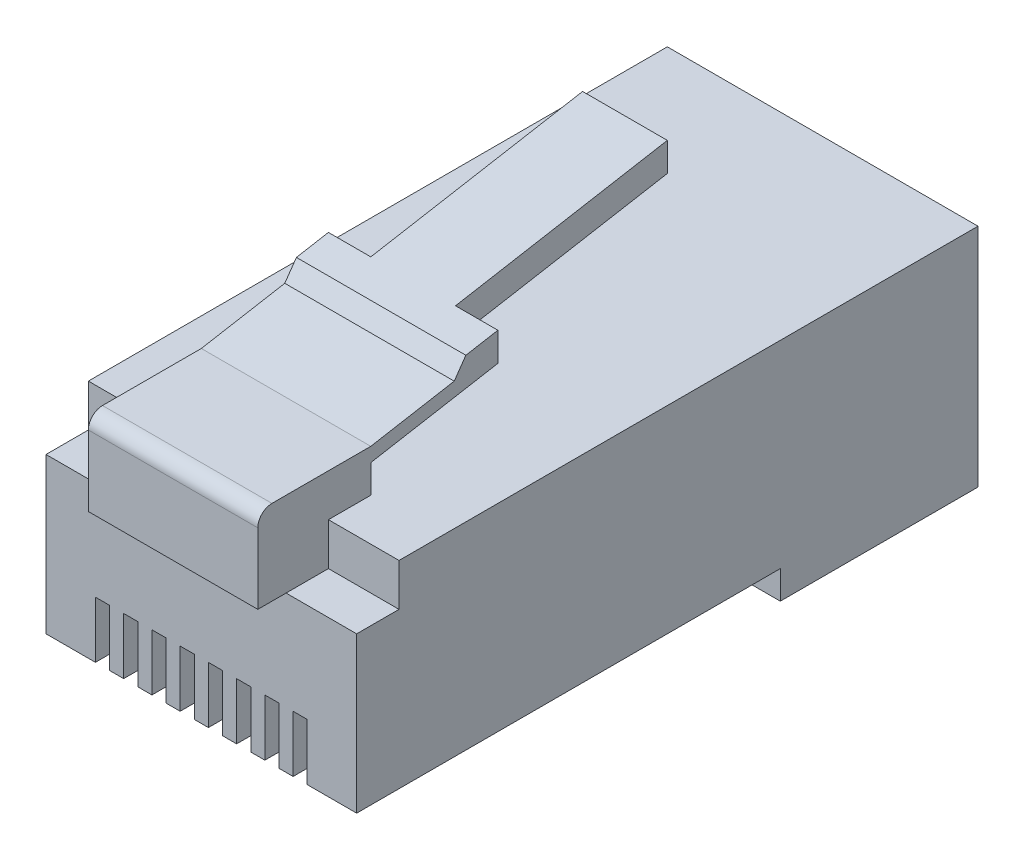
from build123d import *

# Parameters (mm, degrees)
SCHIZZO1_W                           = 11
SCHIZZO1_H                           = 8
ESTRUSIONE_ESTRUSIONE1_DEPTH         = 7
SCHIZZO2_W                           = 11
SCHIZZO2_H                           = 7
ESTRUSIONE_ESTRUSIONE2_DEPTH         = 15
TAGLIO_ESTRUSIONE1_DEPTH             = 7
SCHIZZO4_W                           = 9
SCHIZZO4_H                           = 3
TAGLIO_ESTRUSIONE2_DEPTH             = 2
TAGLIO_ESTRUSIONE3_REACH             = 25.027
SCHIZZO5_W                           = 2
SCHIZZO5_H                           = 3
TAGLIO_ESTRUSIONE3_DIRECTION_2_REACH = 25.027
SCHIZZO6_W                           = 0.5
SCHIZZO6_H                           = 3
TAGLIO_ESTRUSIONE4_DEPTH             = 4
SCHIZZO7_W                           = 0.5
SCHIZZO7_H                           = 0.5
TAGLIO_ESTRUSIONE5_DEPTH             = 2
ESTRUSIONE_ESTRUSIONE7_DEPTH         = 4
ESTRUSIONE_ESTRUSIONE7_DEPTH_BACK    = 4
SCHIZZO9_W                           = 0.5
SCHIZZO9_H                           = 7
SCHIZZO9_W_2                         = 0.75
ESTRUSIONE_ESTRUSIONE8_DEPTH         = 0.5
RACCORDO1_R                          = 0.2
SMUSSO1_SIZE                         = 0.2
SCHIZZO10_W                          = 1.5
SCHIZZO10_H                          = 1.5
TAGLIO_ESTRUSIONE6_DEPTH             = 25.919871589
ESTRUSIONE_ESTRUSIONE9_DEPTH         = 3
ESTRUSIONE_ESTRUSIONE9_DEPTH_BACK    = 3
SCHIZZO12_W                          = 1.5
SCHIZZO12_H                          = 3.13135038
TAGLIO_ESTRUSIONE7_DEPTH             = 7.5


with BuildPart() as part:
    # Schizzo1 → Estrusione-Estrusione1 (new body)
    with BuildSketch(Plane.XY):
        Rectangle(SCHIZZO1_W, SCHIZZO1_H)
    extrude(amount=ESTRUSIONE_ESTRUSIONE1_DEPTH)

    # Schizzo2 → Estrusione-Estrusione2 (add)
    with BuildSketch(Plane.XY.offset(7)):
        with Locations((0, 0.5)):
            Rectangle(SCHIZZO2_W, SCHIZZO2_H)
    extrude(amount=ESTRUSIONE_ESTRUSIONE2_DEPTH)

    # Schizzo3 → Taglio-Estrusione1 (cut)
    with BuildSketch(Plane(origin=(0, 0, 0), x_dir=(-1, 0, 0), z_dir=(0, 0, -1))):
        with BuildLine():
            Line((-4.5, 2.5), (-4.5, -2))
            Line((-4.5, -2), (4.5, -2))
            Line((4.5, -2), (4.5, 2.5))
            ThreePointArc((4.5, 2.5), (0, 3.56971445), (-4.5, 2.5))
        make_face()
    extrude(amount=-TAGLIO_ESTRUSIONE1_DEPTH, mode=Mode.SUBTRACT)

    # Schizzo4 → Taglio-Estrusione2 (cut)
    with BuildSketch(Plane.XZ.offset(4)):
        with Locations((0, 4.5)):
            Rectangle(SCHIZZO4_W, SCHIZZO4_H)
    extrude(amount=-TAGLIO_ESTRUSIONE2_DEPTH, mode=Mode.SUBTRACT)

    # Taglio-Estrusione3: up to this face of the body (flat: up to its plane)
    taglio_estrusione3_end = Plane(part.part.faces().sort_by_distance((-4.5, -0.27, 3.66))[0])
    # Schizzo5 → Taglio-Estrusione3 (cut, up to the picked face)
    with BuildSketch(Plane(origin=(0, 0, 0), x_dir=(0, 0, -1), z_dir=(1, 0, 0)), mode=Mode.PRIVATE) as taglio_estrusione3_sk1:
        with BuildLine():
            Line((-7, -2), (-7, 2.5))
            Line((-7, 2.5), (-8, 2.5))
            Line((-8, 2.5), (-8.5, 2))
            Line((-8.5, 2), (-21.5, 2))
            Line((-21.5, 2), (-21.5, 1))
            Line((-21.5, 1), (-12.196152423, 1))
            ThreePointArc((-12.196152423, 1), (-9.196152423, 0.196152423), (-7, -2))
        make_face()
    taglio_estrusione3_tool1 = split(extrude(taglio_estrusione3_sk1.sketch, amount=-TAGLIO_ESTRUSIONE3_REACH, mode=Mode.PRIVATE), bisect_by=taglio_estrusione3_end, keep=Keep.BOTH, mode=Mode.PRIVATE)
    # Schizzo5 → Taglio-Estrusione3 (cut, up to the picked face)
    with BuildSketch(Plane(origin=(0, 0, 0), x_dir=(0, 0, -1), z_dir=(1, 0, 0)), mode=Mode.PRIVATE) as taglio_estrusione3_sk2:
        Polygon((-9, -3), (-9, -1.5), (-10, -0.5), (-12.5, -0.5), (-12.5, -3), align=None)
    taglio_estrusione3_tool2 = split(extrude(taglio_estrusione3_sk2.sketch, amount=-TAGLIO_ESTRUSIONE3_REACH, mode=Mode.PRIVATE), bisect_by=taglio_estrusione3_end, keep=Keep.BOTH, mode=Mode.PRIVATE)
    # Schizzo5 → Taglio-Estrusione3 (cut, up to the picked face)
    with BuildSketch(Plane(origin=(0, 0, 0), x_dir=(0, 0, -1), z_dir=(1, 0, 0)), mode=Mode.PRIVATE) as taglio_estrusione3_sk3:
        with Locations((-15, -1.5)):
            Rectangle(SCHIZZO5_W, SCHIZZO5_H)
    taglio_estrusione3_tool3 = split(extrude(taglio_estrusione3_sk3.sketch, amount=-TAGLIO_ESTRUSIONE3_REACH, mode=Mode.PRIVATE), bisect_by=taglio_estrusione3_end, keep=Keep.BOTH, mode=Mode.PRIVATE)
    add(taglio_estrusione3_tool1.solids().sort_by(Axis((0, 1.213893, 12.650368), (-1, 0, 0)))[0], mode=Mode.SUBTRACT)
    add(taglio_estrusione3_tool2.solids().sort_by(Axis((0, -1.805556, 10.835859), (-1, 0, 0)))[0], mode=Mode.SUBTRACT)
    add(taglio_estrusione3_tool3.solids().sort_by(Axis((0, -1.5, 15), (-1, 0, 0)))[0], mode=Mode.SUBTRACT)

    # Taglio-Estrusione3 direction 2: up to this face of the body (flat: up to its plane)
    taglio_estrusione3_direction_2_end = Plane(part.part.faces().sort_by_distance((4.5, -0.27, 3.66))[0])
    # Schizzo5 → Taglio-Estrusione3 direction 2 (cut, up to the picked face)
    with BuildSketch(Plane(origin=(0, 0, 0), x_dir=(0, 0, -1), z_dir=(1, 0, 0)), mode=Mode.PRIVATE) as taglio_estrusione3_direction_2_sk1:
        with BuildLine():
            Line((-7, -2), (-7, 2.5))
            Line((-7, 2.5), (-8, 2.5))
            Line((-8, 2.5), (-8.5, 2))
            Line((-8.5, 2), (-21.5, 2))
            Line((-21.5, 2), (-21.5, 1))
            Line((-21.5, 1), (-12.196152423, 1))
            ThreePointArc((-12.196152423, 1), (-9.196152423, 0.196152423), (-7, -2))
        make_face()
    taglio_estrusione3_direction_2_tool1 = split(extrude(taglio_estrusione3_direction_2_sk1.sketch, amount=TAGLIO_ESTRUSIONE3_DIRECTION_2_REACH, mode=Mode.PRIVATE), bisect_by=taglio_estrusione3_direction_2_end, keep=Keep.BOTH, mode=Mode.PRIVATE)
    # Schizzo5 → Taglio-Estrusione3 direction 2 (cut, up to the picked face)
    with BuildSketch(Plane(origin=(0, 0, 0), x_dir=(0, 0, -1), z_dir=(1, 0, 0)), mode=Mode.PRIVATE) as taglio_estrusione3_direction_2_sk2:
        Polygon((-9, -3), (-9, -1.5), (-10, -0.5), (-12.5, -0.5), (-12.5, -3), align=None)
    taglio_estrusione3_direction_2_tool2 = split(extrude(taglio_estrusione3_direction_2_sk2.sketch, amount=TAGLIO_ESTRUSIONE3_DIRECTION_2_REACH, mode=Mode.PRIVATE), bisect_by=taglio_estrusione3_direction_2_end, keep=Keep.BOTH, mode=Mode.PRIVATE)
    # Schizzo5 → Taglio-Estrusione3 direction 2 (cut, up to the picked face)
    with BuildSketch(Plane(origin=(0, 0, 0), x_dir=(0, 0, -1), z_dir=(1, 0, 0)), mode=Mode.PRIVATE) as taglio_estrusione3_direction_2_sk3:
        with Locations((-15, -1.5)):
            Rectangle(SCHIZZO5_W, SCHIZZO5_H)
    taglio_estrusione3_direction_2_tool3 = split(extrude(taglio_estrusione3_direction_2_sk3.sketch, amount=TAGLIO_ESTRUSIONE3_DIRECTION_2_REACH, mode=Mode.PRIVATE), bisect_by=taglio_estrusione3_direction_2_end, keep=Keep.BOTH, mode=Mode.PRIVATE)
    add(taglio_estrusione3_direction_2_tool1.solids().sort_by(Axis((0, 1.213893, 12.650368), (1, 0, 0)))[0], mode=Mode.SUBTRACT)
    add(taglio_estrusione3_direction_2_tool2.solids().sort_by(Axis((0, -1.805556, 10.835859), (1, 0, 0)))[0], mode=Mode.SUBTRACT)
    add(taglio_estrusione3_direction_2_tool3.solids().sort_by(Axis((0, -1.5, 15), (1, 0, 0)))[0], mode=Mode.SUBTRACT)

    # Schizzo6 → Taglio-Estrusione4 (cut)
    with BuildSketch(Plane.XZ.offset(3)):
        with Locations((-3.5, 20)):
            Rectangle(SCHIZZO6_W, SCHIZZO6_H)
        with Locations((-2.5, 20)):
            Rectangle(SCHIZZO6_W, SCHIZZO6_H)
        with Locations((-1.5, 20)):
            Rectangle(SCHIZZO6_W, SCHIZZO6_H)
        with Locations((-0.5, 20)):
            Rectangle(SCHIZZO6_W, SCHIZZO6_H)
        with Locations((0.5, 20)):
            Rectangle(SCHIZZO6_W, SCHIZZO6_H)
        with Locations((1.5, 20)):
            Rectangle(SCHIZZO6_W, SCHIZZO6_H)
        with Locations((2.5, 20)):
            Rectangle(SCHIZZO6_W, SCHIZZO6_H)
        with Locations((3.5, 20)):
            Rectangle(SCHIZZO6_W, SCHIZZO6_H)
    extrude(amount=-TAGLIO_ESTRUSIONE4_DEPTH, mode=Mode.SUBTRACT)

    # Schizzo7 → Taglio-Estrusione5 (cut)
    with BuildSketch(Plane.XZ.offset(3)):
        with Locations((-3.5, 21.75)):
            Rectangle(SCHIZZO7_W, SCHIZZO7_H)
        with Locations((-2.5, 21.75)):
            Rectangle(SCHIZZO7_W, SCHIZZO7_H)
        with Locations((-1.5, 21.75)):
            Rectangle(SCHIZZO7_W, SCHIZZO7_H)
        with Locations((-0.5, 21.75)):
            Rectangle(SCHIZZO7_W, SCHIZZO7_H)
        with Locations((0.5, 21.75)):
            Rectangle(SCHIZZO7_W, SCHIZZO7_H)
        with Locations((1.5, 21.75)):
            Rectangle(SCHIZZO7_W, SCHIZZO7_H)
        with Locations((2.5, 21.75)):
            Rectangle(SCHIZZO7_W, SCHIZZO7_H)
        with Locations((3.5, 21.75)):
            Rectangle(SCHIZZO7_W, SCHIZZO7_H)
    extrude(amount=-TAGLIO_ESTRUSIONE5_DEPTH, mode=Mode.SUBTRACT)

    # Schizzo8 → Estrusione-Estrusione7 (add, two sides: drawn at the far end of the back side and taken through both)
    with BuildSketch(Plane(origin=(0, 0, 0), x_dir=(0, 0, -1), z_dir=(1, 0, 0)).offset(-ESTRUSIONE_ESTRUSIONE7_DEPTH_BACK)):
        with BuildLine():
            Line((-6, -2), (-6, -2.3))
            Line((-6, -2.3), (-5.022904001, -2.512798985))
            Line((-5.022904001, -2.512798985), (-3.268414576, -4))
            Line((-3.268414576, -4), (-3.031110437, -2.785373321))
            ThreePointArc((-3.031110437, -2.785373321), (-3.051323254, -2.652170285), (-3.151437659, -2.562010912))
            ThreePointArc((-3.151437659, -2.562010912), (-4.548262793, -2.141844043), (-6, -2))
        make_face()
    extrude(amount=ESTRUSIONE_ESTRUSIONE7_DEPTH + ESTRUSIONE_ESTRUSIONE7_DEPTH_BACK)

    # Schizzo9 → Estrusione-Estrusione8 (add)
    with BuildSketch(Plane(origin=(0, 1, 0), x_dir=(1, 0, 0), z_dir=(0, 1, 0))):
        with Locations((-3, -18)):
            Rectangle(SCHIZZO9_W, SCHIZZO9_H)
        with Locations((-2, -18)):
            Rectangle(SCHIZZO9_W, SCHIZZO9_H)
        with Locations((-1, -18)):
            Rectangle(SCHIZZO9_W, SCHIZZO9_H)
        with Locations((0, -18)):
            Rectangle(SCHIZZO9_W, SCHIZZO9_H)
        with Locations((1, -18)):
            Rectangle(SCHIZZO9_W, SCHIZZO9_H)
        with Locations((2, -18)):
            Rectangle(SCHIZZO9_W, SCHIZZO9_H)
        with Locations((3, -18)):
            Rectangle(SCHIZZO9_W, SCHIZZO9_H)
        with Locations((4.125, -18)):
            Rectangle(SCHIZZO9_W_2, SCHIZZO9_H)
        with Locations((-4.125, -18)):
            Rectangle(SCHIZZO9_W_2, SCHIZZO9_H)
    extrude(amount=ESTRUSIONE_ESTRUSIONE8_DEPTH)

    # Raccordo1
    raccordo1_edges = [part.edges().sort_by_distance(p)[0] for p in [
        (-3.25, 1.25, 14.5),
        (-2.75, 1.25, 14.5),
        (3.75, 1.25, 14.5),
        (-1.75, 1.25, 14.5),
        (-2.25, 1.25, 14.5),
        (-0.75, 1.25, 14.5),
        (-1.25, 1.25, 14.5),
        (0.25, 1.25, 14.5),
        (-0.25, 1.25, 14.5),
        (1.25, 1.25, 14.5),
        (0.75, 1.25, 14.5),
        (2.25, 1.25, 14.5),
        (1.75, 1.25, 14.5),
        (3.25, 1.25, 14.5),
        (2.75, 1.25, 14.5),
        (-3.75, 1.25, 14.5),
    ]]
    fillet(raccordo1_edges, radius=RACCORDO1_R)

    # Smusso1
    smusso1_edges = [part.edges().sort_by_distance(p)[0] for p in [
        (-2.75, 1.5, 18.1),
        (4.225, 1.5, 14.5),
        (-1.75, 1.5, 18.1),
        (-0.75, 1.5, 18.1),
        (0.25, 1.5, 18.1),
        (1.25, 1.5, 18.1),
        (2.25, 1.5, 18.1),
        (3.25, 1.5, 18.1),
        (-3.75, 1.5, 18.1),
        (-3.25, 1.5, 18.1),
        (-3, 1.5, 14.5),
        (-2.808578644, 1.5, 14.558578644),
        (-3.191421356, 1.5, 14.558578644),
        (-2.25, 1.5, 18.1),
        (-2, 1.5, 14.5),
        (-1.808578644, 1.5, 14.558578644),
        (-2.191421356, 1.5, 14.558578644),
        (-1.25, 1.5, 18.1),
        (-1, 1.5, 14.5),
        (-0.808578644, 1.5, 14.558578644),
        (-1.191421356, 1.5, 14.558578644),
        (-0.25, 1.5, 18.1),
        (0, 1.5, 14.5),
        (0.191421356, 1.5, 14.558578644),
        (-0.191421356, 1.5, 14.558578644),
        (0.75, 1.5, 18.1),
        (1, 1.5, 14.5),
        (1.191421356, 1.5, 14.558578644),
        (0.808578644, 1.5, 14.558578644),
        (1.75, 1.5, 18.1),
        (2, 1.5, 14.5),
        (2.191421356, 1.5, 14.558578644),
        (1.808578644, 1.5, 14.558578644),
        (2.75, 1.5, 18.1),
        (3, 1.5, 14.5),
        (3.191421356, 1.5, 14.558578644),
        (2.808578644, 1.5, 14.558578644),
        (-4.225, 1.5, 14.5),
        (-3.808578644, 1.5, 14.558578644),
        (3.75, 1.5, 18.1),
        (3.808578644, 1.5, 14.558578644),
    ]]
    chamfer(smusso1_edges, length=SMUSSO1_SIZE)

    # Schizzo10 → Taglio-Estrusione6 (cut, through all)
    with BuildSketch(Plane(origin=(5.5, 0, 0), x_dir=(0, 0, -1), z_dir=(1, 0, 0))):
        with Locations((-21.25, 3.25)):
            Rectangle(SCHIZZO10_W, SCHIZZO10_H)
    extrude(amount=-TAGLIO_ESTRUSIONE6_DEPTH, mode=Mode.SUBTRACT)

    # Schizzo11 → Estrusione-Estrusione9 (add, two sides: drawn at the far end of the back side and taken through both)
    with BuildSketch(Plane(origin=(0, 0, 0), x_dir=(0, 0, -1), z_dir=(1, 0, 0)).offset(-ESTRUSIONE_ESTRUSIONE9_DEPTH_BACK)):
        with BuildLine():
            Line((-20.5, 2.5), (-23, 2.5))
            Line((-23, 2.5), (-23, 5))
            ThreePointArc((-23, 5), (-22.853553391, 5.353553391), (-22.5, 5.5))
            Line((-22.5, 5.5), (-19, 5.5))
            Line((-19, 5.5), (-16.045576741, 6.020944533))
            Line((-16.045576741, 6.020944533), (-15.633835285, 6.608972273))
            Line((-15.633835285, 6.608972273), (-7, 8.13135038))
            Line((-7, 8.13135038), (-7, 7.115923769))
            Line((-7, 7.115923769), (-19, 5))
            Line((-19, 5), (-19, 4))
            Line((-19, 4), (-20.5, 4))
            Line((-20.5, 4), (-20.5, 2.5))
        make_face()
    extrude(amount=ESTRUSIONE_ESTRUSIONE9_DEPTH + ESTRUSIONE_ESTRUSIONE9_DEPTH_BACK)

    # Schizzo12 → Taglio-Estrusione7 (cut)
    with BuildSketch(Plane(origin=(0, 0, 7), x_dir=(-1, 0, 0), z_dir=(0, 0, -1))):
        with Locations((-2.25, 6.56567519)):
            Rectangle(SCHIZZO12_W, SCHIZZO12_H)
        with Locations((2.25, 6.56567519)):
            Rectangle(SCHIZZO12_W, SCHIZZO12_H)
    extrude(amount=-TAGLIO_ESTRUSIONE7_DEPTH, mode=Mode.SUBTRACT)


solid = part.part
